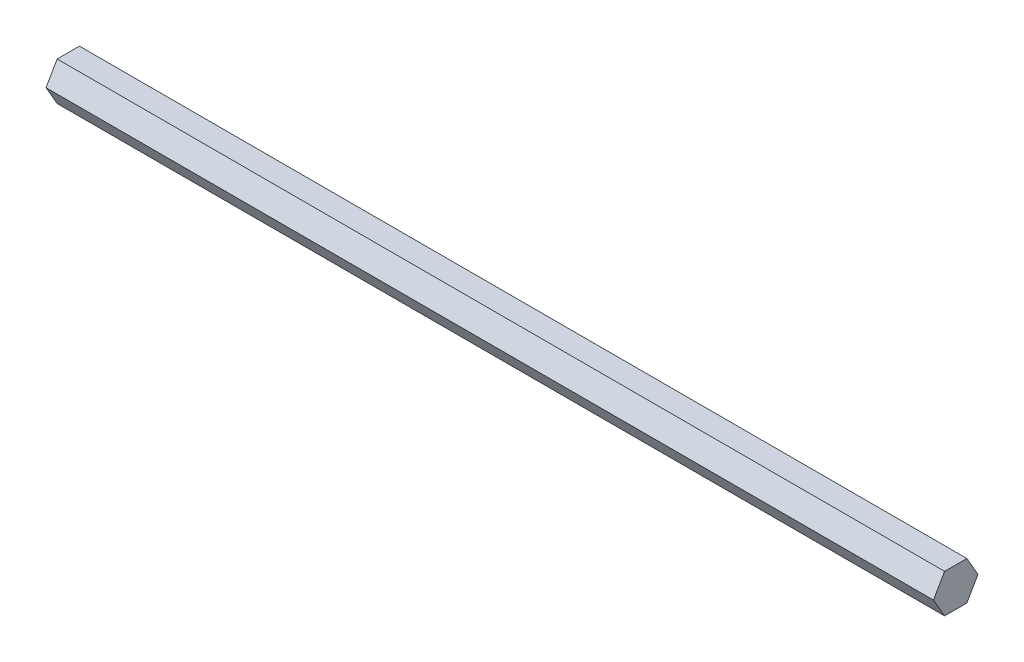
from build123d import *

# Parameters (mm, degrees)
BOSS_EXTRUDE1_DEPTH = 292.1


with BuildPart() as part:
    # Sketch1 → Boss-Extrude1 (new body)
    with BuildSketch(Plane(origin=(0, 0, 0), x_dir=(0, 0, -1), z_dir=(1, 0, 0))):
        Polygon((7.332348419, 0), (3.666174209, 6.35), (-3.666174209, 6.35), (-7.332348419, 0), (-3.666174209, -6.35), (3.666174209, -6.35), align=None)
    extrude(amount=BOSS_EXTRUDE1_DEPTH)


solid = part.part
